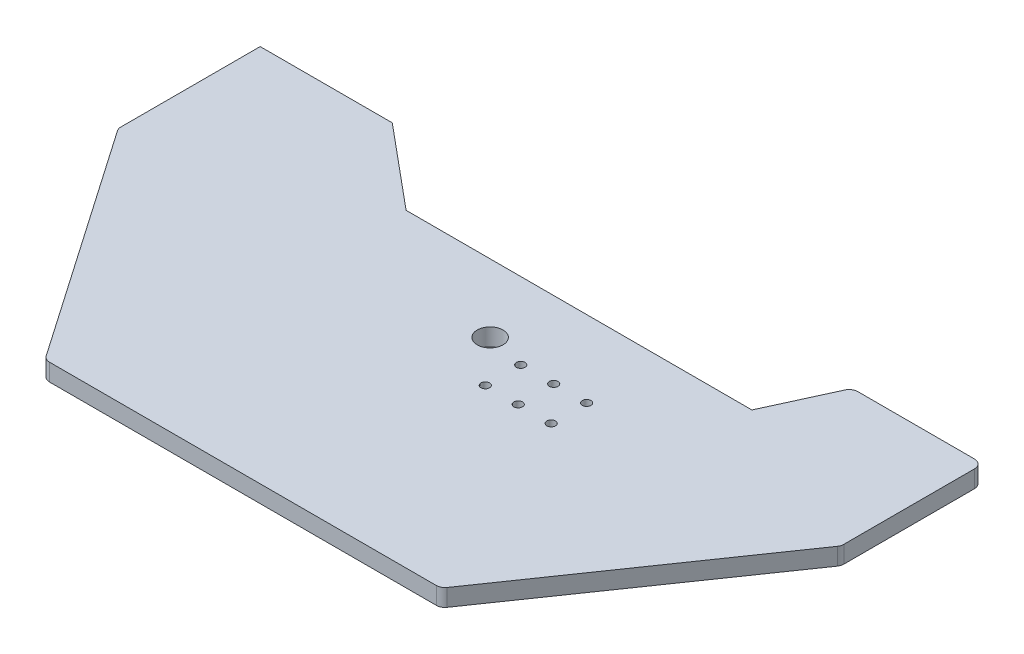
from build123d import *

# Parameters (mm, degrees)
BOSS_EXTRUDE1_DEPTH = 6.35
SKETCH2_R           = 3.175
CUT_EXTRUDE1_DEPTH  = 302.34078715
CUT_EXTRUDE2_DEPTH  = 302.34078715
FILLET1_R           = 6.35
SKETCH4_R           = 9.525
CUT_EXTRUDE3_DEPTH  = 302.34078715


with BuildPart() as part:
    # Sketch1 → Boss-Extrude1 (new, symmetric)
    with BuildSketch(Plane(origin=(0, 0, 0), x_dir=(1, 0, 0), z_dir=(0, 1, 0))):
        Polygon((-266.7, -139.7), (266.7, -139.7), (266.7, 139.7), (170.18, 139.7), (146.939, 88.9), (-108.237741638, 88.9), (-169.2275, 139.7), (-266.7, 139.7), align=None)
    extrude(amount=BOSS_EXTRUDE1_DEPTH, both=True)

    # Sketch2 → Cut-Extrude1 (cut, through all)
    with BuildSketch(Plane(origin=(0, 6.35, 0), x_dir=(1, 0, 0), z_dir=(0, 1, 0))):
        with Locations(Location((81.4832, 6.2484, 0), (0, 0, 270))):
            Circle(SKETCH2_R)
        with Locations(Location((81.4832, 32.4104, 0), (0, 0, 270))):
            Circle(SKETCH2_R)
        with Locations(Location((57.1627, 32.4104, 0), (0, 0, 270))):
            Circle(SKETCH2_R)
        with Locations(Location((32.8422, 32.4104, 0), (0, 0, 270))):
            Circle(SKETCH2_R)
        with Locations(Location((32.8422, 6.2484, 0), (0, 0, 270))):
            Circle(SKETCH2_R)
        with Locations(Location((57.1627, 6.2484, 0), (0, 0, 270))):
            Circle(SKETCH2_R)
    extrude(amount=-CUT_EXTRUDE1_DEPTH, mode=Mode.SUBTRACT)

    # Sketch3 → Cut-Extrude2 (cut, through all)
    with BuildSketch(Plane(origin=(0, 6.35, 0), x_dir=(1, 0, 0), z_dir=(0, 1, 0))):
        Polygon((-266.7, 34.925), (-146.05, -139.7), (-266.7, -139.7), align=None)
    cut_extrude2 = extrude(amount=-CUT_EXTRUDE2_DEPTH, mode=Mode.SUBTRACT)

    # Mirror1: Cut-Extrude2 across plane
    add(cut_extrude2.mirror(Plane(origin=(0, 0, 0), x_dir=(0, 0, 1), z_dir=(1, 0, 0))), mode=Mode.SUBTRACT)

    # Fillet1
    fillet1_edges = [part.edges().sort_by_distance(p)[0] for p in [
        (170.18, 0, -139.7),
        (266.7, 0, -139.7),
        (-266.7, 0, -34.925),
        (-146.05, 0, 139.7),
        (266.7, 0, -34.925),
        (146.05, 0, 139.7),
    ]]
    fillet(fillet1_edges, radius=FILLET1_R)

    # Sketch4 → Cut-Extrude3 (cut, through all)
    with BuildSketch(Plane(origin=(0, 6.35, 0), x_dir=(1, 0, 0), z_dir=(0, 1, 0))):
        with Locations(Location((3.99970692, 38.675446652, 0), (0, 0, 270))):
            Circle(SKETCH4_R)
    extrude(amount=-CUT_EXTRUDE3_DEPTH, mode=Mode.SUBTRACT)


solid = part.part
